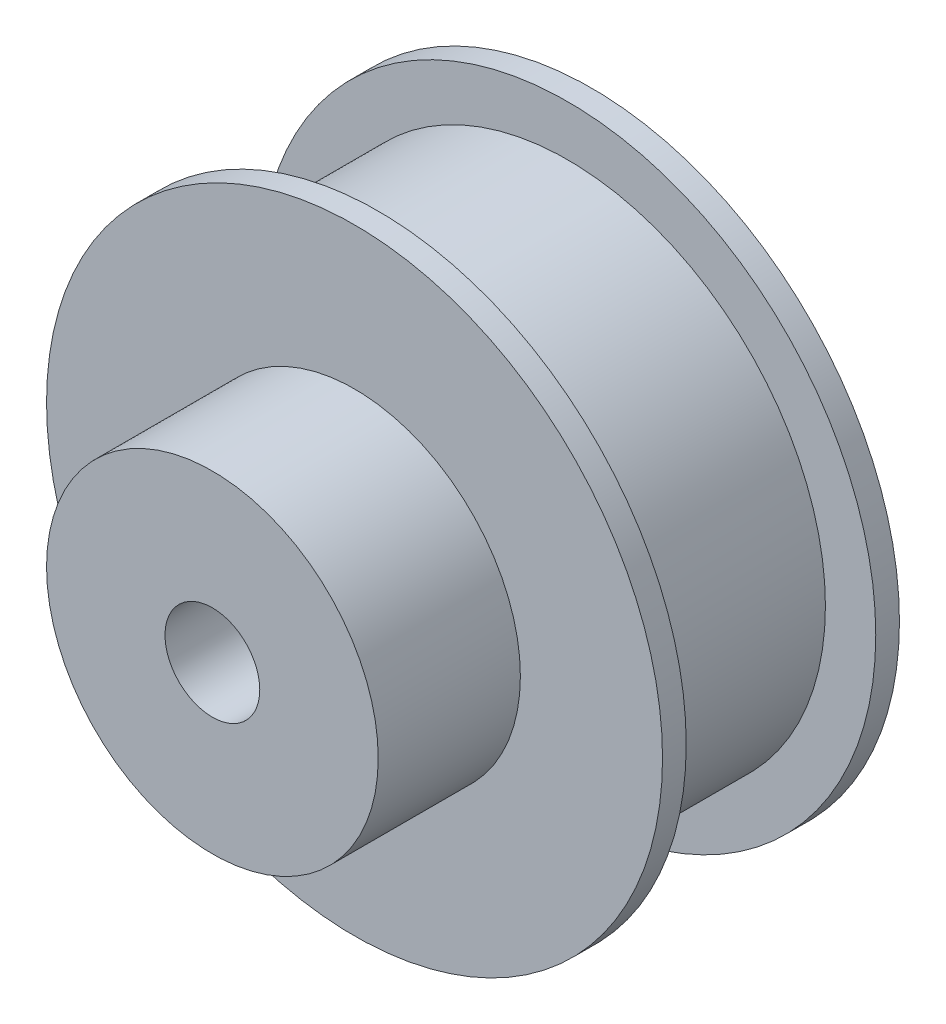
from build123d import *

# Parameters (mm, degrees)
ESQUISSE1_R      = 13
EXTRUSION1_DEPTH = 1
ESQUISSE2_R      = 10.875
EXTRUSION2_DEPTH = 8
ESQUISSE3_R      = 13
EXTRUSION3_DEPTH = 1
ESQUISSE4_R      = 7
EXTRUSION4_DEPTH = 6
ESQUISSE5_R      = 2
EXTRUSION5_DEPTH = 25.372115214


with BuildPart() as part:
    # Esquisse1 → Extrusion1 (new body)
    with BuildSketch(Plane.XY):
        Circle(ESQUISSE1_R)
    extrude(amount=EXTRUSION1_DEPTH)

    # Esquisse2 → Extrusion2 (add)
    with BuildSketch(Plane.XY.offset(1)):
        Circle(ESQUISSE2_R)
    extrude(amount=EXTRUSION2_DEPTH)

    # Esquisse3 → Extrusion3 (add)
    with BuildSketch(Plane.XY.offset(9)):
        Circle(ESQUISSE3_R)
    extrude(amount=EXTRUSION3_DEPTH)

    # Esquisse4 → Extrusion4 (add)
    with BuildSketch(Plane.XY.offset(10)):
        Circle(ESQUISSE4_R)
    extrude(amount=EXTRUSION4_DEPTH)

    # Esquisse5 → Extrusion5 (cut, through all)
    with BuildSketch(Plane.XY.offset(16)):
        Circle(ESQUISSE5_R)
    extrude(amount=-EXTRUSION5_DEPTH, mode=Mode.SUBTRACT)


solid = part.part
